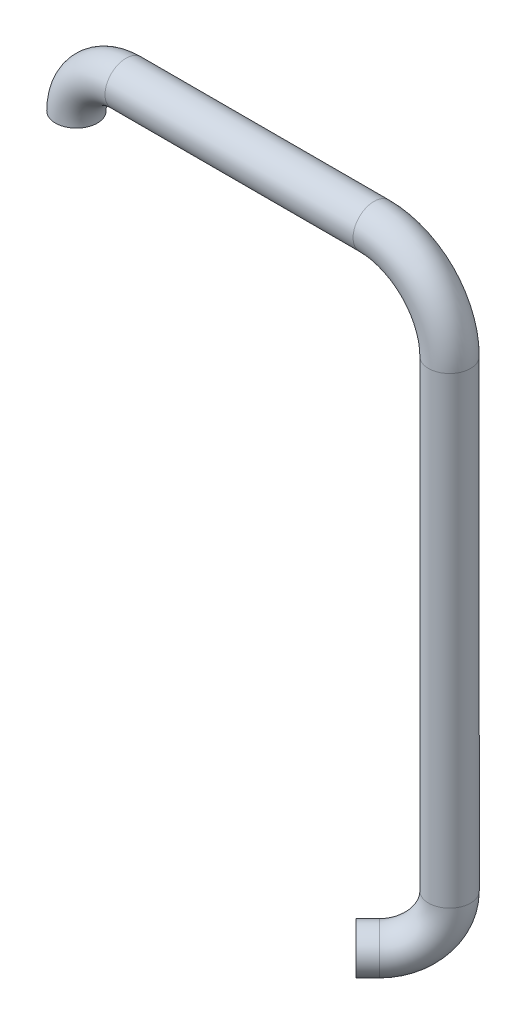
from build123d import *

# Parameters (mm, degrees)
SWEEP3_PROFILE_R = 12.7
SHELL2_T         = -3


with BuildPart() as part:
    # Sweep3: sweep along a curve in space
    with BuildLine() as sweep3_path:
        Line((182.284830693, -340, 25.410722948), (175.213762881, -340, 32.48179076))
        ThreePointArc((203.498034128, -310, 4.197519512), (197.284830693, -331.213203436, 10.410722948), (182.284830693, -340, 25.410722948))
        Line((203.498034128, -30, 4.197519512), (203.498034128, -310, 4.197519512))
        ThreePointArc((157.832678043, 15.665356086, 4.197519512), (190.122960996, 2.290282953, 4.197519512), (203.498034128, -30, 4.197519512))
        Line((7.832678043, 15.665356086, 4.197519512), (157.832678043, 15.665356086, 4.197519512))
        ThreePointArc((7.832678043, 15.665356086, 4.197519512), (-13.380525393, 6.878559521, 4.197519512), (-22.167321957, -14.334643914, 4.197519512))
    # Sweep3 profile (on start of the path) → Sweep3 (sweep)
    with BuildSketch(Plane(origin=(-22.167321957, -14.334643914, 4.197519512), x_dir=(1, 0, 0), z_dir=(0, 1, 0))):
        Circle(SWEEP3_PROFILE_R)
    sweep(path=sweep3_path.line)

    # Shell2
    shell2_openings = [part.faces().sort_by_distance(p)[0] for p in [
        (-22.167321957, -14.334643914, 4.197519512),
        (175.213762881, -340, 32.48179076),
    ]]
    offset(amount=SHELL2_T, openings=shell2_openings, kind=Kind.INTERSECTION)


solid = part.part
